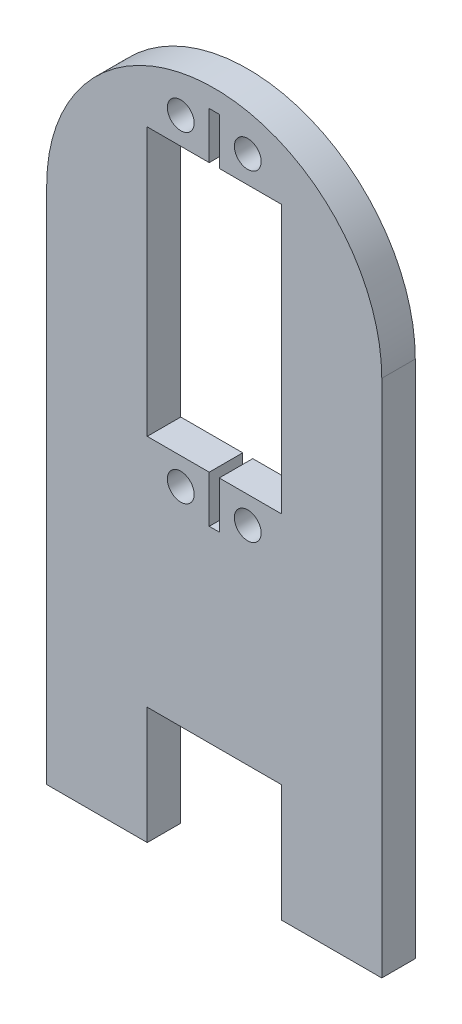
from build123d import *

# Parameters (mm, degrees)
SKETCH1_R           = 2
BOSS_EXTRUDE1_DEPTH = 5


with BuildPart() as part:
    # Sketch1 → Boss-Extrude1 (new body)
    with BuildSketch(Plane.XY):
        with BuildLine():
            ThreePointArc((25, 5), (0, 30), (-25, 5))
            Line((-25, 5), (-25, -72.5))
            Line((-25, -72.5), (-10, -72.5))
            Line((-10, -72.5), (-10, -55))
            Line((-10, -55), (10, -55))
            Line((10, -55), (10, -72.5))
            Line((10, -72.5), (25, -72.5))
            Line((25, -72.5), (25, 5))
        make_face()
        Polygon((-10, 20), (-0.75, 20), (-0.75, 27), (0.75, 27), (0.75, 20), (10, 20), (10, -20), (0.75, -20), (0.75, -27), (-0.75, -27), (-0.75, -20), (-10, -20), align=None, mode=Mode.SUBTRACT)
        with Locations((-5, 24)):
            Circle(SKETCH1_R, mode=Mode.SUBTRACT)
        with Locations((5, 24)):
            Circle(SKETCH1_R, mode=Mode.SUBTRACT)
        with Locations((-5, -24)):
            Circle(SKETCH1_R, mode=Mode.SUBTRACT)
        with Locations((5, -24)):
            Circle(SKETCH1_R, mode=Mode.SUBTRACT)
    extrude(amount=BOSS_EXTRUDE1_DEPTH)


solid = part.part
